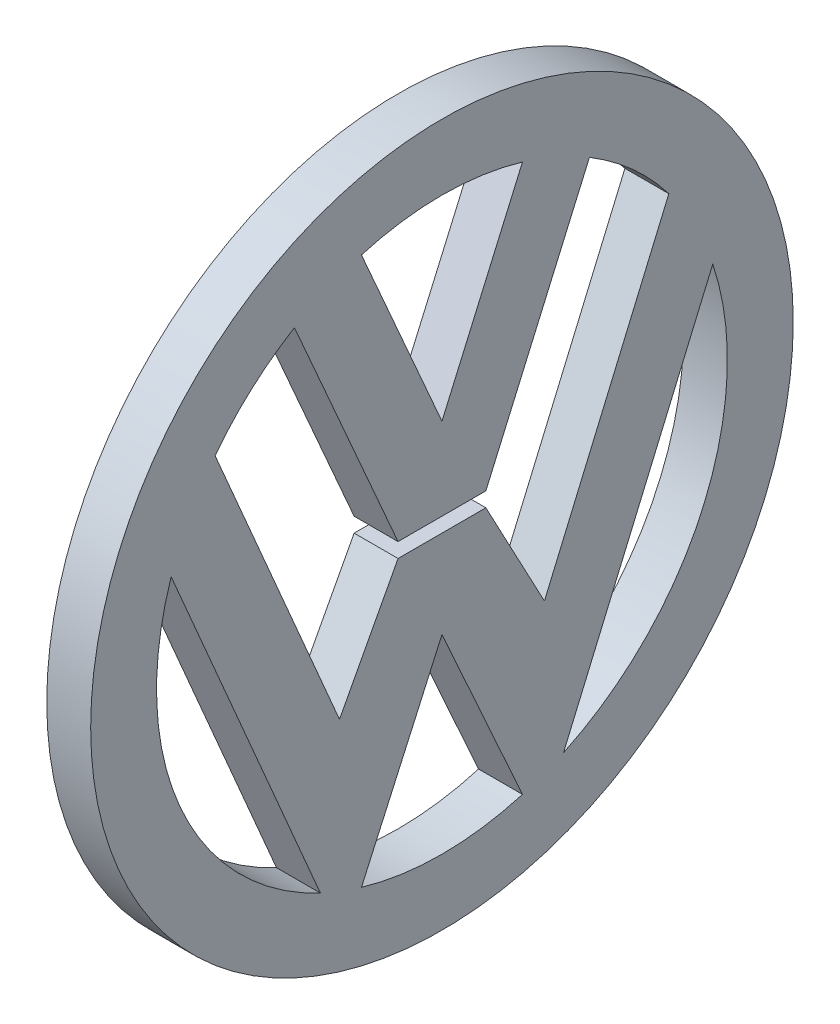
from build123d import *

# Parameters (mm, degrees)
SKETCH_5_R      = 24
EXTRUDE_1_DEPTH = 3


with BuildPart() as part:
    # Эскиз5 → Бобышка-Вытянуть1 (new body)
    with BuildSketch(Plane.ZY):
        Circle(SKETCH_5_R)
        with BuildLine():
            Line((5.5, 18.708286934), (0, 6.121683557))
            Line((0, 6.121683557), (-5.5, 18.708286934))
            ThreePointArc((-5.5, 18.708286934), (0, 19.5), (5.5, 18.708286934))
        make_face(mode=Mode.SUBTRACT)
        with BuildLine():
            Line((10.076621897, 16.694660558), (3, 0.5))
            Line((3, 0.5), (-3, 0.5))
            Line((-3, 0.5), (-10.076621897, 16.694660558))
            ThreePointArc((-10.076621897, 16.694660558), (-13.01736824, 14.518888529), (-15.5, 11.832159566))
            Line((-15.5, 11.832159566), (-7, -8.016467208))
            Line((-7, -8.016467208), (-3, -0.5))
            Line((-3, -0.5), (3, -0.5))
            Line((3, -0.5), (7, -8.016467208))
            Line((7, -8.016467208), (15.5, 11.832159566))
            ThreePointArc((15.5, 11.832159566), (13.01736824, 14.518888529), (10.076621897, 16.694660558))
        make_face(mode=Mode.SUBTRACT)
        with BuildLine():
            Line((0, -6.5), (5.5, -18.708286934))
            ThreePointArc((5.5, -18.708286934), (0, -19.5), (-5.5, -18.708286934))
            Line((-5.5, -18.708286934), (0, -6.5))
        make_face(mode=Mode.SUBTRACT)
        with BuildLine():
            Line((8.30458122, -17.64324037), (18.5, 6.164414003))
            ThreePointArc((18.5, 6.164414003), (17.925470573, -7.676425257), (8.30458122, -17.64324037))
        make_face(mode=Mode.SUBTRACT)
        with BuildLine():
            Line((-8.30458122, -17.64324037), (-18.5, 6.164414003))
            ThreePointArc((-18.5, 6.164414003), (-17.925470573, -7.676425257), (-8.30458122, -17.64324037))
        make_face(mode=Mode.SUBTRACT)
    extrude(amount=EXTRUDE_1_DEPTH)


solid = part.part
